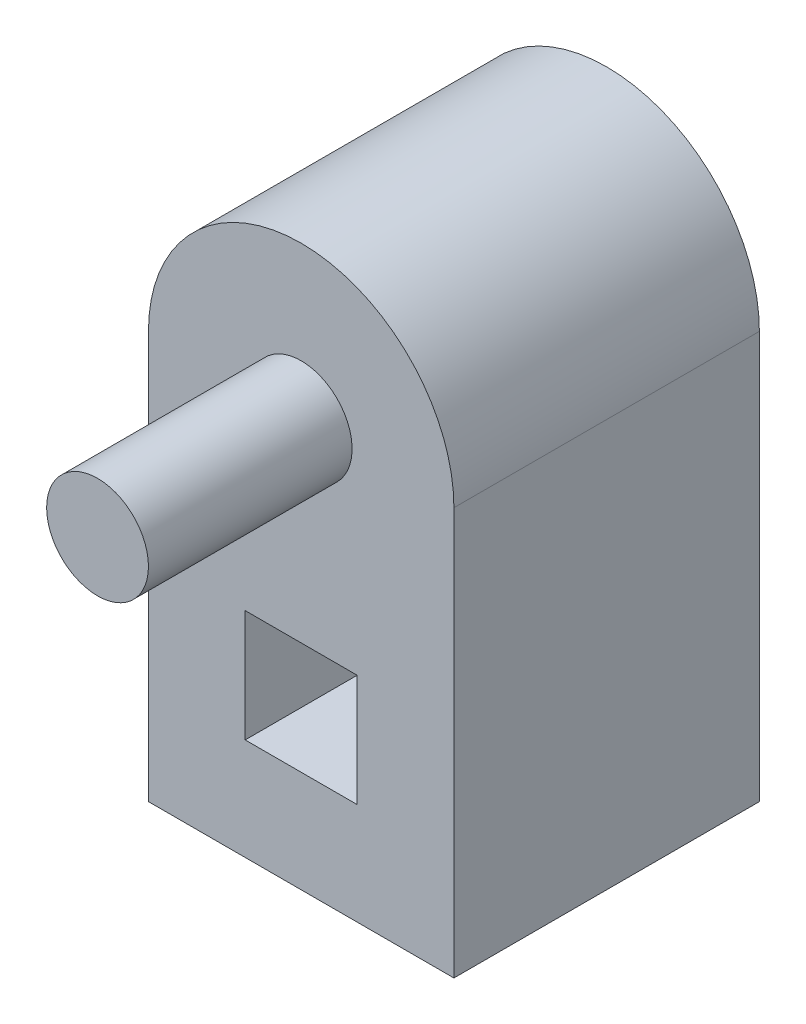
from build123d import *

# Parameters (mm, degrees)
SKETCH1_W                = 76.2
SKETCH1_H                = 76.2
BOSS_EXTRUDE1_DEPTH      = 101.6
BOSS_EXTRUDE2_DEPTH      = 38.1
BOSS_EXTRUDE2_DEPTH_BACK = 38.1
SKETCH2_R                = 38.1
CUT_EXTRUDE1_DEPTH       = 150.730791756
CUT_EXTRUDE1_DEPTH_BACK  = 150.730791756
SKETCH3_W                = 27.94
SKETCH3_H                = 27.94
SKETCH4_R                = 12.7
BOSS_EXTRUDE3_DEPTH      = 88.9


with BuildPart() as part:
    # Sketch1 → Boss-Extrude1 (new body)
    with BuildSketch(Plane(origin=(0, 0, 0), x_dir=(1, 0, 0), z_dir=(0, 1, 0))):
        Rectangle(SKETCH1_W, SKETCH1_H)
    extrude(amount=BOSS_EXTRUDE1_DEPTH)

    # Sketch2 → Boss-Extrude2 (add, two sides: drawn at the far end of the back side and taken through both)
    with BuildSketch(Plane.XY.offset(-BOSS_EXTRUDE2_DEPTH_BACK)):
        with Locations((0, 101.6)):
            Circle(SKETCH2_R)
    extrude(amount=BOSS_EXTRUDE2_DEPTH + BOSS_EXTRUDE2_DEPTH_BACK)

    # Sketch3 → Cut-Extrude1 (cut, two sides: drawn at the far end of the back side and taken through both)
    with BuildSketch(Plane.XY.offset(-CUT_EXTRUDE1_DEPTH_BACK)):
        with Locations((0, 39.37)):
            Rectangle(SKETCH3_W, SKETCH3_H)
    extrude(amount=CUT_EXTRUDE1_DEPTH + CUT_EXTRUDE1_DEPTH_BACK, mode=Mode.SUBTRACT)

    # Sketch4 → Boss-Extrude3 (add)
    with BuildSketch(Plane.XY):
        with Locations(Location((0, 101.6, 0), (0, 0, 180))):
            Circle(SKETCH4_R)
    extrude(amount=BOSS_EXTRUDE3_DEPTH)


solid = part.part
